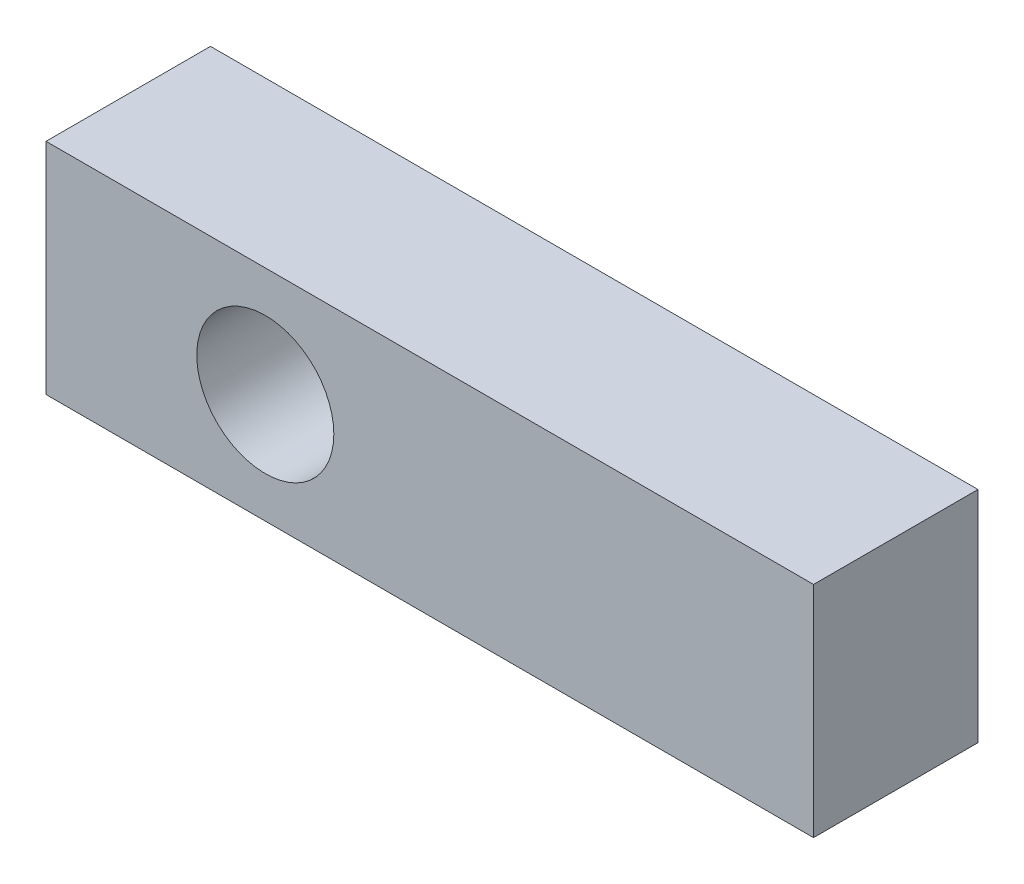
from build123d import *

# Parameters (mm, degrees)
SKICA1_W                 = 28
SKICA1_H                 = 8
P_IDAT_VYSUNUT_M2_DEPTH  = 6
SKICA2_R                 = 2.5
ODEBRAT_VYSUNUT_M1_DEPTH = 16.748015748


with BuildPart() as part:
    # Skica1 → Přidat vysunutím2 (new body)
    with BuildSketch(Plane.XY):
        Rectangle(SKICA1_W, SKICA1_H)
    extrude(amount=P_IDAT_VYSUNUT_M2_DEPTH)

    # Skica2 → Odebrat vysunutím1 (cut, through all)
    with BuildSketch(Plane.XY.offset(6)):
        with Locations((-6, 0)):
            Circle(SKICA2_R)
    extrude(amount=-ODEBRAT_VYSUNUT_M1_DEPTH, mode=Mode.SUBTRACT)


solid = part.part
